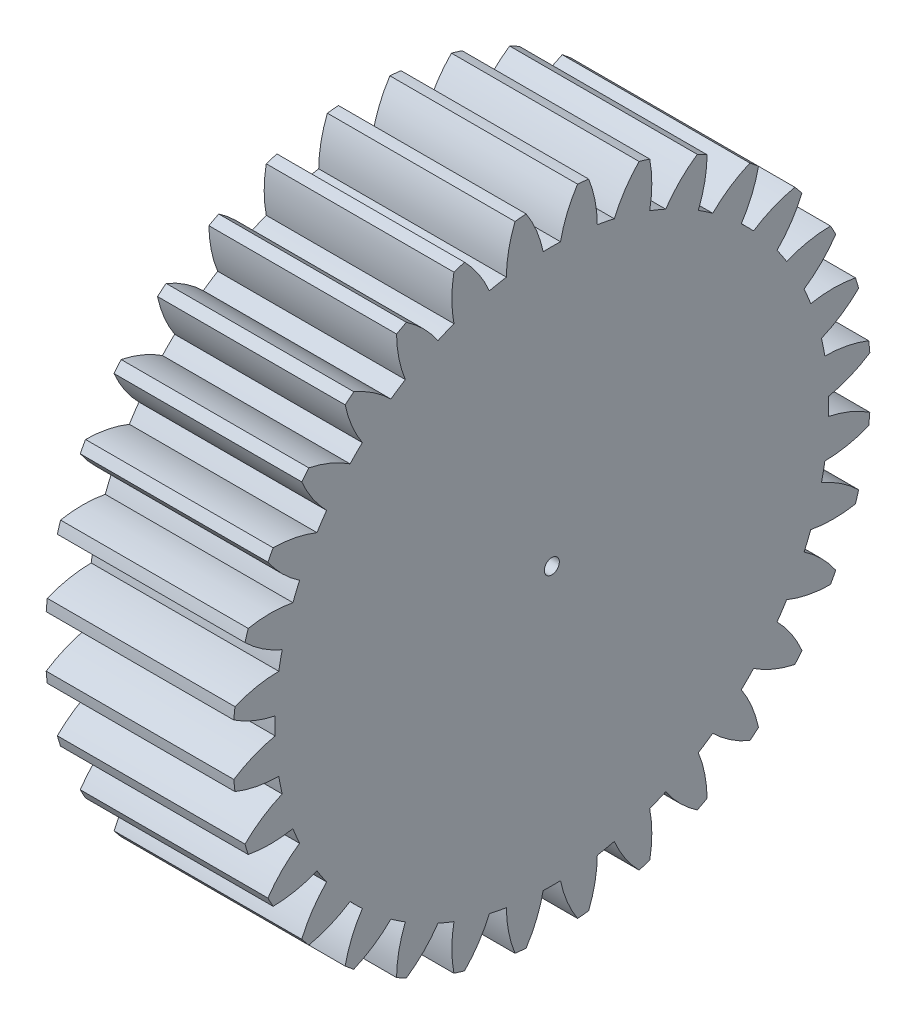
from build123d import *

# Parameters (mm, degrees)
BASPROSKE_W     = 10
BASPROSKE_H     = 17
TOOTHCUT_DEPTH  = 27.038433133
TEETHCUTS_COUNT = 32
TEETHCUTS_ANGLE = 348.75
BORSKE_R        = 0.4
BORE_DEPTH      = 50.0000508


with BuildPart() as part:
    # BasProSke → Base-Revolve (revolve)
    with BuildSketch(Plane(origin=(0, 0, 0), x_dir=(1, 0, 0), z_dir=(0, 1, 0)), mode=Mode.PRIVATE) as base_revolve_sk:
        with Locations((5, 8.5)):
            Rectangle(BASPROSKE_W, BASPROSKE_H)
    revolve(base_revolve_sk.sketch.rotate(Axis((-10, 0, 0), (1, 0, 0)), 180), axis=Axis((-10, 0, 0), (1, 0, 0)))

    # TooCutSke → ToothCut (cut, through all)
    with BuildSketch(Plane(origin=(0, 0, 0), x_dir=(0, 0, -1), z_dir=(1, 0, 0))):
        with BuildLine():
            ThreePointArc((0.462036907, 14.741761187), (0, 14.749), (-0.462036907, 14.741761187))
            ThreePointArc((-0.462036907, 14.741761187), (-0.81854142, 15.899240468), (-1.386721275, 16.9688317))
            ThreePointArc((-1.386721275, 16.9688317), (0, 17.0254), (1.386721275, 16.9688317))
            ThreePointArc((1.386721275, 16.9688317), (0.81854142, 15.899240468), (0.462036907, 14.741761187))
        make_face()
    toothcut = extrude(amount=TOOTHCUT_DEPTH, mode=Mode.SUBTRACT)

    # TeethCuts: ToothCut ×32 about axis
    teethcuts_axis = Axis((-10, 0, 0), (1, 0, 0))
    for i in range(1, TEETHCUTS_COUNT):
        add(toothcut.rotate(teethcuts_axis, i * TEETHCUTS_ANGLE / (TEETHCUTS_COUNT - 1)), mode=Mode.SUBTRACT)

    # BorSke → Bore (cut, symmetric)
    with BuildSketch(Plane(origin=(0, 0, 0), x_dir=(0, 0, -1), z_dir=(1, 0, 0))):
        with Locations(Location((0, 0, 0), (0, 0, 180))):
            Circle(BORSKE_R)
    extrude(amount=BORE_DEPTH, both=True, mode=Mode.SUBTRACT)


solid = part.part
